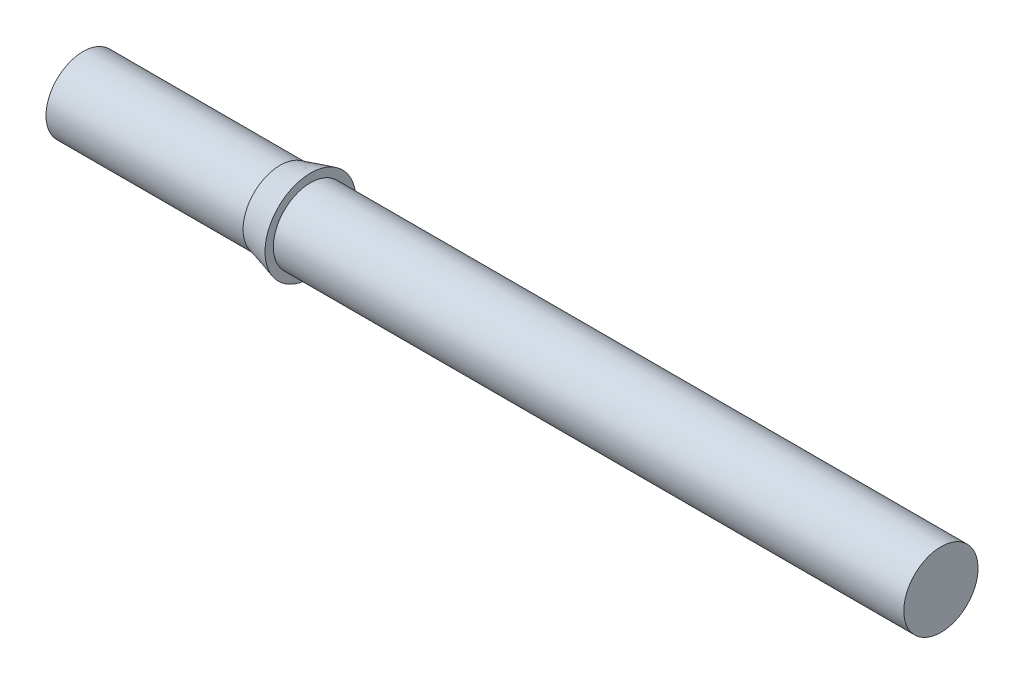
from build123d import *

# Parameters (mm, degrees)
SKETCH3_R           = 2.45
BOSS_EXTRUDE1_DEPTH = 56.6
SKETCH5_R           = 3
SKETCH4_R           = 2.45


with BuildPart() as part:
    # Sketch3 → Boss-Extrude1 (new body)
    with BuildSketch(Plane.ZY.offset(52.96859286)):
        with Locations((-1.872748601, -1.671429972)):
            Circle(SKETCH3_R)
    extrude(amount=-BOSS_EXTRUDE1_DEPTH)

    # Sketch5 → Loft1 section 0
    with BuildSketch(Plane.ZY.offset(37.96859286)):
        with Locations((-1.872748601, -1.671429972)):
            Circle(SKETCH5_R)
    # Sketch4 → Loft1 section 1
    with BuildSketch(Plane.ZY.offset(39.96859286)):
        with Locations((-1.872748601, -1.671429972)):
            Circle(SKETCH4_R)
    loft()


solid = part.part
